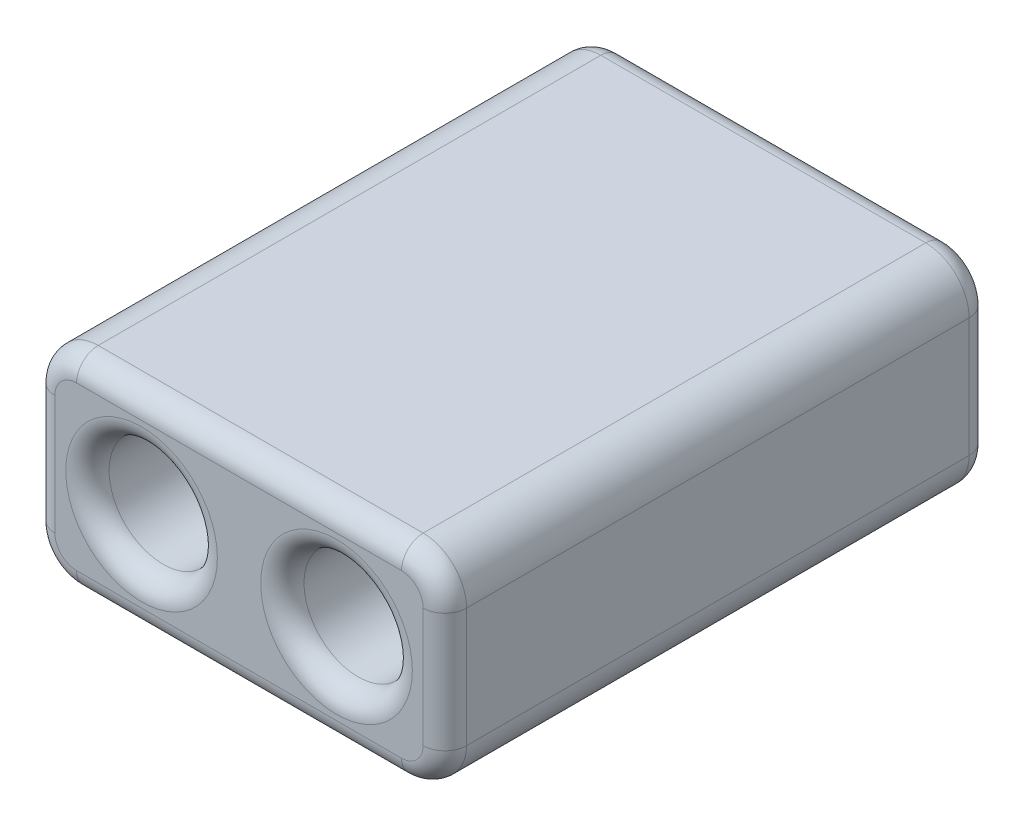
from build123d import *

# Parameters (mm, degrees)
SKETCH_1_W      = 19
SKETCH_1_H      = 9.5
SKETCH_1_R      = 2.5
EXTRUDE_1_DEPTH = 25.2
FILLET_1_R      = 2
FILLET_2_R      = 1
FILLET_3_R      = 1


with BuildPart() as part:
    # Эскиз1 → Бобышка-Вытянуть1 (new body)
    with BuildSketch(Plane.XY):
        Rectangle(SKETCH_1_W, SKETCH_1_H)
        with Locations((-4.5, 0)):
            Circle(SKETCH_1_R, mode=Mode.SUBTRACT)
        with Locations((4.5, 0)):
            Circle(SKETCH_1_R, mode=Mode.SUBTRACT)
    extrude(amount=EXTRUDE_1_DEPTH)

    # Скругление1
    fillet_1_edges = [part.edges().sort_by_distance(p)[0] for p in [
        (9.5, -4.75, 12.6),
        (-9.5, -4.75, 12.6),
        (-9.5, 4.75, 12.6),
        (9.5, 4.75, 12.6),
    ]]
    fillet(fillet_1_edges, radius=FILLET_1_R)

    # Скругление2
    fillet_2_edges = [part.edges().sort_by_distance(p)[0] for p in [
        (-7, 0, 25.2),
        (2, 0, 25.2),
        (9.5, 0, 25.2),
        (0, -4.75, 25.2),
        (0, 4.75, 25.2),
        (-9.5, 0, 25.2),
        (-8.914213562, 4.164213562, 25.2),
        (-8.914213562, -4.164213562, 25.2),
        (8.914213562, 4.164213562, 25.2),
        (8.914213562, -4.164213562, 25.2),
    ]]
    fillet(fillet_2_edges, radius=FILLET_2_R)

    # Скругление3
    fillet_3_edges = [part.edges().sort_by_distance(p)[0] for p in [
        (-7, 0, 0),
        (2, 0, 0),
        (9.5, 0, 0),
        (0, -4.75, 0),
        (-9.5, 0, 0),
        (0, 4.75, 0),
        (-8.914213562, 4.164213562, 0),
        (-8.914213562, -4.164213562, 0),
        (8.914213562, 4.164213562, 0),
        (8.914213562, -4.164213562, 0),
    ]]
    fillet(fillet_3_edges, radius=FILLET_3_R)


solid = part.part
